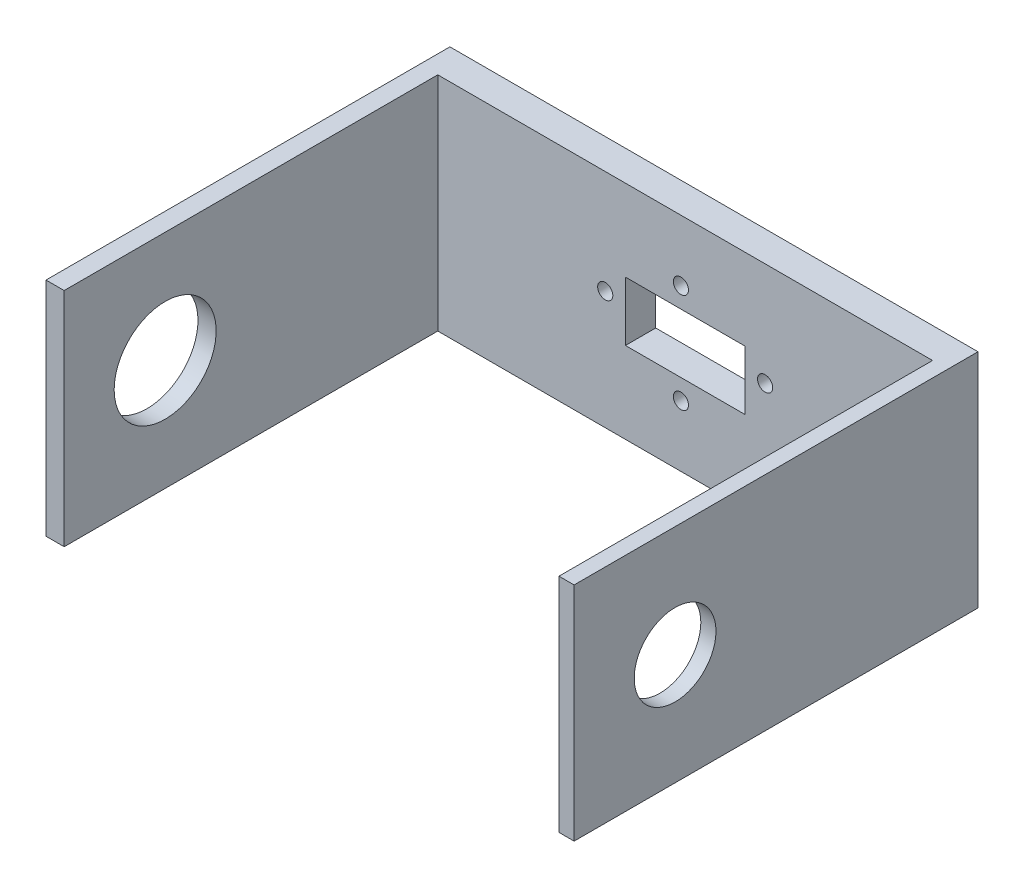
from build123d import *

# Parameters (mm, degrees)
ESBO_O1_W                = 49
ESBO_O1_H                = 21.976467336
ESBO_O1_R                = 0.750862634
ESBO_O1_W_2              = 11.832091764
ESBO_O1_H_2              = 5.865635034
RESSALTO_EXTRUS_O1_DEPTH = 3
ESBO_O2_W                = 40
ESBO_O2_H                = 21.976467336
ESBO_O2_R                = 5.05
RESSALTO_EXTRUS_O2_DEPTH = 1.8
ESBO_O3_W                = 40
ESBO_O3_H                = 21.97646734
ESBO_O3_R                = 4.05
RESSALTO_EXTRUS_O3_DEPTH = 1.5


with BuildPart() as part:
    # Esboço1 → Ressalto-extrusão1 (new body)
    with BuildSketch(Plane.XY):
        Rectangle(ESBO_O1_W, ESBO_O1_H)
        with Locations((-0.421929048, 4.932817517)):
            Circle(ESBO_O1_R, mode=Mode.SUBTRACT)
        with Locations((7.916045882, 0.729927039)):
            Circle(ESBO_O1_R, mode=Mode.SUBTRACT)
        with Locations(Location((-0.421929048, -4.932817517, 0), (0, 0, 180))):
            Circle(ESBO_O1_R, mode=Mode.SUBTRACT)
        with Locations(Location((-7.916045882, 0.729927039, 0), (0, 0, 180))):
            Circle(ESBO_O1_R, mode=Mode.SUBTRACT)
        Rectangle(ESBO_O1_W_2, ESBO_O1_H_2, mode=Mode.SUBTRACT)
    extrude(amount=RESSALTO_EXTRUS_O1_DEPTH)

    # Esboço2 → Ressalto-extrusão2 (add)
    with BuildSketch(Plane.ZY.offset(24.5)):
        with Locations((20, 0)):
            Rectangle(ESBO_O2_W, ESBO_O2_H)
        with Locations((30, 0)):
            Circle(ESBO_O2_R, mode=Mode.SUBTRACT)
    extrude(amount=RESSALTO_EXTRUS_O2_DEPTH)

    # Esboço3 → Ressalto-extrusão3 (add)
    with BuildSketch(Plane(origin=(24.5, 0, 0), x_dir=(0, 0, -1), z_dir=(1, 0, 0))):
        with Locations((-20, -2e-09)):
            Rectangle(ESBO_O3_W, ESBO_O3_H)
        with Locations((-30, 0)):
            Circle(ESBO_O3_R, mode=Mode.SUBTRACT)
    extrude(amount=RESSALTO_EXTRUS_O3_DEPTH)


solid = part.part
